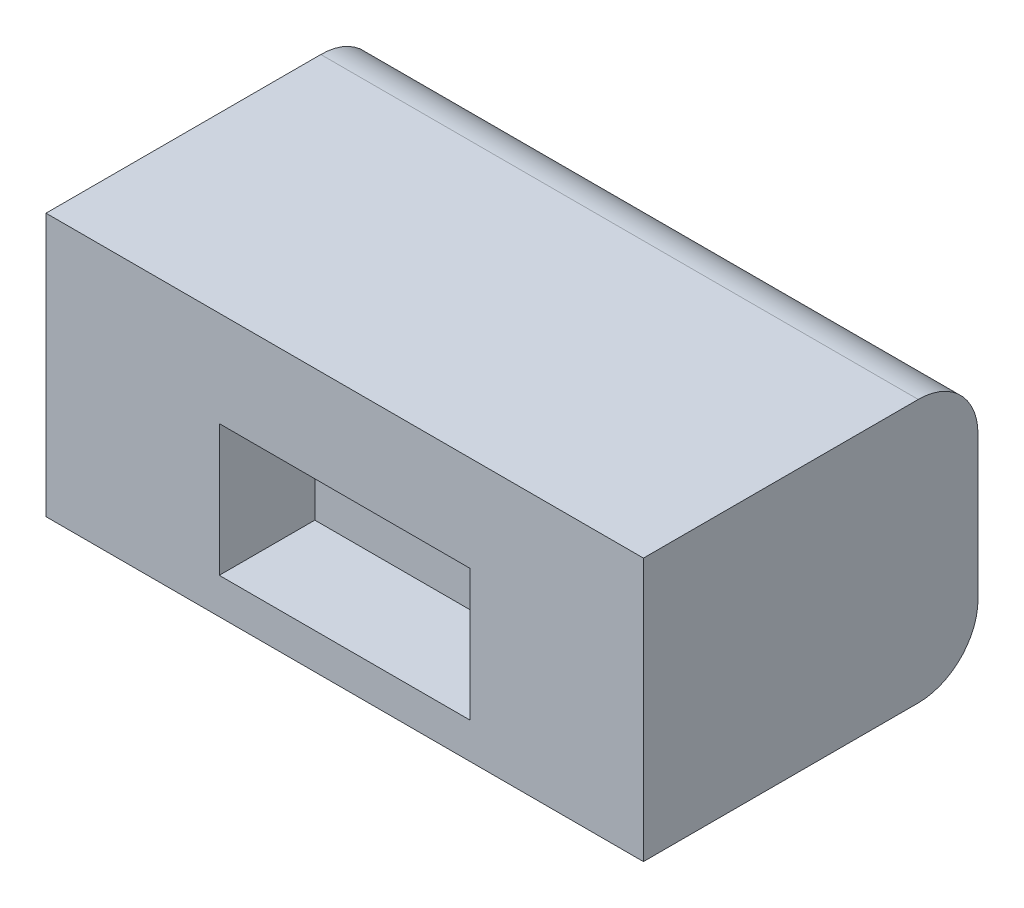
from build123d import *

# Parameters (mm, degrees)
SKETCH_1_W          = 5
SKETCH_1_H          = 2.2
EXTRUDE_1_DEPTH     = 2.8
SKETCH_2_W          = 2.1
SKETCH_2_H          = 1.1
CUT_EXTRUDE_1_DEPTH = 0.8
FILLET_1_R          = 0.5


with BuildPart() as part:
    # 草图1 → 凸台-拉伸1 (new body)
    with BuildSketch(Plane.XY):
        Rectangle(SKETCH_1_W, SKETCH_1_H)
    extrude(amount=EXTRUDE_1_DEPTH)

    # 草图2 → 切除-拉伸1 (cut)
    with BuildSketch(Plane.XY.offset(2.8)):
        with Locations((0, -0.25)):
            Rectangle(SKETCH_2_W, SKETCH_2_H)
    extrude(amount=-CUT_EXTRUDE_1_DEPTH, mode=Mode.SUBTRACT)

    # 圆角1
    fillet_1_edges = [part.edges().sort_by_distance(p)[0] for p in [
        (0, -1.1, 0),
        (0, 1.1, 0),
    ]]
    fillet(fillet_1_edges, radius=FILLET_1_R)


solid = part.part
